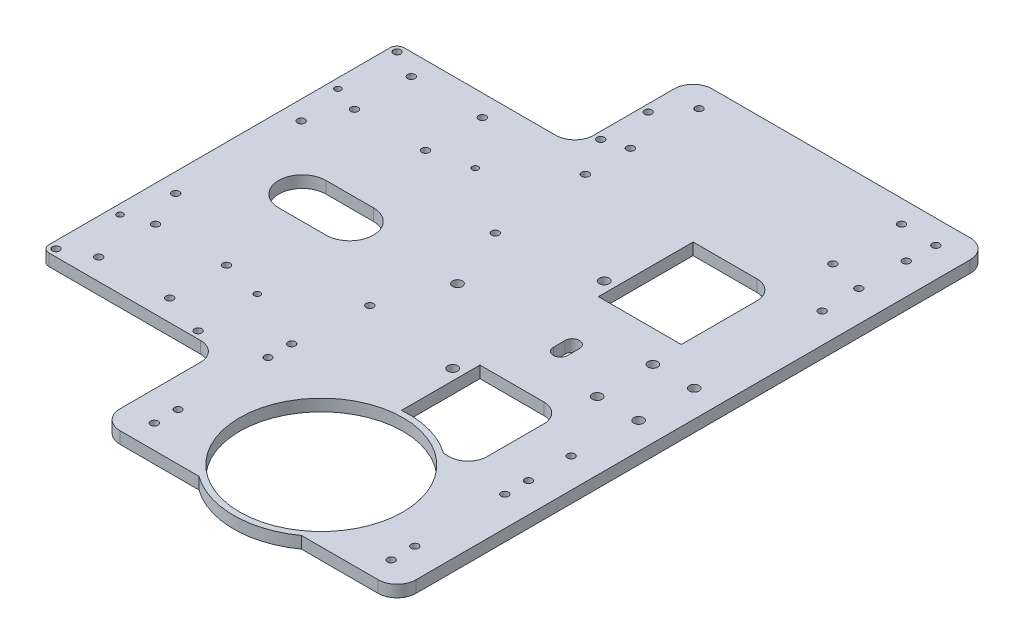
from build123d import *

# Parameters (mm, degrees)
SKETCH_1_W               = 200
SKETCH_1_H               = 250
EXTRUDE_1_DEPTH          = 5
SKETCH_2_W               = 150
SKETCH_2_H               = 100
CUT_EXTRUDE_1_DEPTH      = 10
SKETCH_3_R               = 1.55
CUT_EXTRUDE_2_DEPTH      = 10
CUT_EXTRUDE_3_DEPTH      = 10
CUT_EXTRUDE_3_DEPTH_BACK = 5
SKETCH_6_R               = 2.05
SKETCH_6_W               = 35
SKETCH_6_H               = 40
SKETCH_7_R               = 35
CUT_EXTRUDE_4_DEPTH      = 5
SKETCH_8_R               = 2.05
CUT_EXTRUDE_5_DEPTH      = 161.15617378
SKETCH_10_R              = 1.55
CUT_EXTRUDE_6_DEPTH      = 10
SKETCH_11_R              = 1.55
CUT_EXTRUDE_7_DEPTH      = 5
SKETCH_14_R              = 1.55
CUT_EXTRUDE_10_DEPTH     = 5
SKETCH_16_R              = 1.3
CUT_EXTRUDE_11_DEPTH     = 5
SKETCH_18_R              = 34.5
EXTRUDE_2_DEPTH          = 5
FILLET_1_R               = 8
SKETCH_19_R              = 1.55
CUT_EXTRUDE_12_DEPTH     = 10
SKETCH_20_R              = 1.55
CUT_EXTRUDE_13_DEPTH     = 10
CUT_EXTRUDE_14_DEPTH     = 10
FILLET_2_R               = 3
FILLET_3_R               = 8
CUT_EXTRUDE_15_DEPTH     = 10
SKETCH_23_R              = 1.55
CUT_EXTRUDE_16_DEPTH     = 10
SKETCH_24_R              = 1.55
CUT_EXTRUDE_17_DEPTH     = 10


with BuildPart() as part:
    # 草图1 → 凸台-拉伸1 (new body)
    with BuildSketch(Plane(origin=(0, 0, 0), x_dir=(1, 0, 0), z_dir=(0, 1, 0))):
        Rectangle(SKETCH_1_W, SKETCH_1_H)
    extrude(amount=EXTRUDE_1_DEPTH)

    # 草图2 → 切除-拉伸1 (cut)
    with BuildSketch(Plane(origin=(0, 5, 0), x_dir=(1, 0, 0), z_dir=(0, 1, 0))):
        with Locations((-100, 125)):
            Rectangle(SKETCH_2_W, SKETCH_2_H)
        with Locations((-100, -125)):
            Rectangle(SKETCH_2_W, SKETCH_2_H)
    extrude(amount=-CUT_EXTRUDE_1_DEPTH, mode=Mode.SUBTRACT)

    # 草图3 → 切除-拉伸2 (cut)
    with BuildSketch(Plane(origin=(0, 0, 0), x_dir=(-1, 0, 0), z_dir=(0, -1, 0))):
        with Locations(Location((85, 66, 0), (0, 0, 90))):
            Circle(SKETCH_3_R)
        with Locations(Location((55, 66, 0), (0, 0, 90))):
            Circle(SKETCH_3_R)
        with Locations(Location((55, 42, 0), (0, 0, 90))):
            Circle(SKETCH_3_R)
        with Locations(Location((85, 42, 0), (0, 0, 90))):
            Circle(SKETCH_3_R)
        with Locations(Location((55, -42, 0), (0, 0, 90))):
            Circle(SKETCH_3_R)
        with Locations(Location((85, -42, 0), (0, 0, 90))):
            Circle(SKETCH_3_R)
        with Locations(Location((55, -66, 0), (0, 0, 90))):
            Circle(SKETCH_3_R)
        with Locations(Location((85, -66, 0), (0, 0, 90))):
            Circle(SKETCH_3_R)
    extrude(amount=-CUT_EXTRUDE_2_DEPTH, mode=Mode.SUBTRACT)

    # 草图6 → 切除-拉伸3 (cut, two sides: drawn at the far end of the back side and taken through both)
    with BuildSketch(Plane(origin=(0, 0, 0), x_dir=(-1, 0, 0), z_dir=(0, -1, 0)).offset(-CUT_EXTRUDE_3_DEPTH_BACK)):
        with Locations(Location((-30.5, 32, 0), (0, 0, 270))):
            Circle(SKETCH_6_R)
        with Locations(Location((-0.5, 0, 0), (0, 0, 270))):
            Circle(SKETCH_6_R)
        with Locations(Location((-30.5, -32, 0), (0, 0, 270))):
            Circle(SKETCH_6_R)
        with Locations((-52.5, -45)):
            Rectangle(SKETCH_6_W, SKETCH_6_H)
        with Locations((-52.5, 45)):
            Rectangle(SKETCH_6_W, SKETCH_6_H)
    extrude(amount=CUT_EXTRUDE_3_DEPTH + CUT_EXTRUDE_3_DEPTH_BACK, mode=Mode.SUBTRACT)

    # 草图7 → 切除-拉伸4 (cut)
    with BuildSketch(Plane(origin=(0, 0, 0), x_dir=(-1, 0, 0), z_dir=(0, -1, 0))):
        with Locations((-38, -95)):
            Circle(SKETCH_7_R)
    extrude(amount=-CUT_EXTRUDE_4_DEPTH, mode=Mode.SUBTRACT)

    # 草图8 → 切除-拉伸5 (cut, through all)
    with BuildSketch(Plane(origin=(0, 5, 0), x_dir=(1, 0, 0), z_dir=(0, 1, 0))):
        with Locations(Location((71.25, 11.75, 0), (0, 0, 270))):
            Circle(SKETCH_8_R)
        with Locations(Location((88.75, 11.75, 0), (0, 0, 270))):
            Circle(SKETCH_8_R)
        with Locations(Location((88.75, -11.75, 0), (0, 0, 270))):
            Circle(SKETCH_8_R)
        with Locations(Location((71.25, -11.75, 0), (0, 0, 270))):
            Circle(SKETCH_8_R)
    extrude(amount=-CUT_EXTRUDE_5_DEPTH, mode=Mode.SUBTRACT)

    # 草图10 → 切除-拉伸6 (cut)
    with BuildSketch(Plane(origin=(0, 5, 0), x_dir=(1, 0, 0), z_dir=(0, 1, 0))):
        with Locations(Location((-12.5, -67, 0), (0, 0, 270))):
            Circle(SKETCH_10_R)
        with Locations(Location((-12.5, -115, 0), (0, 0, 270))):
            Circle(SKETCH_10_R)
        with Locations(Location((87.5, -67, 0), (0, 0, 270))):
            Circle(SKETCH_10_R)
        with Locations(Location((87.5, -115, 0), (0, 0, 270))):
            Circle(SKETCH_10_R)
    extrude(amount=-CUT_EXTRUDE_6_DEPTH, mode=Mode.SUBTRACT)

    # 草图11 → 切除-拉伸7 (cut)
    with BuildSketch(Plane(origin=(0, 5, 0), x_dir=(1, 0, 0), z_dir=(0, 1, 0))):
        with Locations(Location((87.5, 115, 0), (0, 0, 270))):
            Circle(SKETCH_11_R)
        with Locations(Location((87.5, 67, 0), (0, 0, 270))):
            Circle(SKETCH_11_R)
        with Locations(Location((-12.5, 115, 0), (0, 0, 270))):
            Circle(SKETCH_11_R)
        with Locations(Location((-12.5, 67, 0), (0, 0, 270))):
            Circle(SKETCH_11_R)
    extrude(amount=-CUT_EXTRUDE_7_DEPTH, mode=Mode.SUBTRACT)

    # 草图14 → 切除-拉伸10 (cut)
    with BuildSketch(Plane(origin=(0, 5, 0), x_dir=(1, 0, 0), z_dir=(0, 1, 0))):
        with Locations(Location((-92, -26.5, 0), (0, 0, 270))):
            Circle(SKETCH_14_R)
        with Locations(Location((-92, 26.5, 0), (0, 0, 270))):
            Circle(SKETCH_14_R)
        with Locations(Location((-10, 26.5, 0), (0, 0, 270))):
            Circle(SKETCH_14_R)
        with Locations(Location((-10, -26.5, 0), (0, 0, 270))):
            Circle(SKETCH_14_R)
    extrude(amount=-CUT_EXTRUDE_10_DEPTH, mode=Mode.SUBTRACT)

    # 草图16 → 切除-拉伸11 (cut)
    with BuildSketch(Plane(origin=(0, 5, 0), x_dir=(1, 0, 0), z_dir=(0, 1, 0))):
        with Locations(Location((-96, 46, 0), (0, 0, 270))):
            Circle(SKETCH_16_R)
        with Locations(Location((-38, 46, 0), (0, 0, 270))):
            Circle(SKETCH_16_R)
        with Locations(Location((-38, -46, 0), (0, 0, 270))):
            Circle(SKETCH_16_R)
        with Locations(Location((-96, -46, 0), (0, 0, 270))):
            Circle(SKETCH_16_R)
    extrude(amount=-CUT_EXTRUDE_11_DEPTH, mode=Mode.SUBTRACT)

    # 草图18 → 凸台-拉伸2 (add)
    with BuildSketch(Plane(origin=(0, 5, 0), x_dir=(1, 0, 0), z_dir=(0, 1, 0))):
        with BuildLine():
            ThreePointArc((35, -58.121822171), (12.920127592, -122.202941017), (75, -95))
            ThreePointArc((75, -95), (70.982039506, -78.231426118), (59.800807024, -65.104769392))
            ThreePointArc((59.800807024, -65.104769392), (48.0278599, -59.38480625), (35, -58.121822171))
        make_face()
        with Locations(Location((38, -95, 0), (0, 0, 270))):
            Circle(SKETCH_18_R, mode=Mode.SUBTRACT)
    extrude(amount=-EXTRUDE_2_DEPTH)

    # 圆角1
    fillet_1_edges = [part.edges().sort_by_distance(p)[0] for p in [
        (70, 2.5, -65),
        (70, 2.5, 25),
        (70, 2.5, 65),
    ]]
    fillet(fillet_1_edges, radius=FILLET_1_R)

    # 草图19 → 切除-拉伸12 (cut)
    with BuildSketch(Plane(origin=(0, 5, 0), x_dir=(1, 0, 0), z_dir=(0, 1, 0))):
        with Locations(Location((-97, 72, 0), (0, 0, 270))):
            Circle(SKETCH_19_R)
        with Locations(Location((-97, -72, 0), (0, 0, 270))):
            Circle(SKETCH_19_R)
    extrude(amount=-CUT_EXTRUDE_12_DEPTH, mode=Mode.SUBTRACT)

    # 草图20 → 切除-拉伸13 (cut)
    with BuildSketch(Plane(origin=(0, 5, 0), x_dir=(1, 0, 0), z_dir=(0, 1, 0))):
        with Locations(Location((72.498529399, 115.5, 0), (0, 0, 270))):
            Circle(SKETCH_20_R)
        with Locations(Location((72.5, 86.5, 0), (0, 0, 270))):
            Circle(SKETCH_20_R)
        with Locations(Location((87, 103, 0), (0, 0, 270))):
            Circle(SKETCH_20_R)
        with Locations(Location((87, 83, 0), (0, 0, 270))):
            Circle(SKETCH_20_R)
        with Locations(Location((-22, 103, 0), (0, 0, 270))):
            Circle(SKETCH_20_R)
        with Locations(Location((-22, 83, 0), (0, 0, 270))):
            Circle(SKETCH_20_R)
        with Locations(Location((-12.5, 86, 0), (0, 0, 270))):
            Circle(SKETCH_20_R)
    extrude(amount=-CUT_EXTRUDE_13_DEPTH, mode=Mode.SUBTRACT)

    # 草图21 → 切除-拉伸14 (cut)
    with BuildSketch(Plane(origin=(0, 5, 0), x_dir=(1, 0, 0), z_dir=(0, 1, 0))):
        with BuildLine():
            Line((-65, 10), (-45, 10))
            ThreePointArc((-45, 10), (-35, 0), (-45, -10))
            Line((-45, -10), (-65, -10))
            ThreePointArc((-65, -10), (-75, 0), (-65, 10))
        make_face()
    extrude(amount=-CUT_EXTRUDE_14_DEPTH, mode=Mode.SUBTRACT)

    # 圆角2
    fillet_2_edges = [part.edges().sort_by_distance(p)[0] for p in [
        (-100, 2.5, -75),
        (-100, 2.5, 75),
    ]]
    fillet(fillet_2_edges, radius=FILLET_2_R)

    # 圆角3
    fillet_3_edges = [part.edges().sort_by_distance(p)[0] for p in [
        (-25, 2.5, -125),
        (-25, 2.5, -75),
        (-25, 2.5, 125),
        (-25, 2.5, 75),
        (100, 2.5, 125),
        (100, 2.5, -125),
    ]]
    fillet(fillet_3_edges, radius=FILLET_3_R)

    # 草图22 → 切除-拉伸15 (cut)
    with BuildSketch(Plane(origin=(0, 0, 0), x_dir=(-1, 0, 0), z_dir=(0, -1, 0))):
        with BuildLine():
            Line((-44, 2), (-44, -3))
            ThreePointArc((-44, -3), (-47, -6), (-50, -3))
            Line((-50, -3), (-50, 2))
            ThreePointArc((-50, 2), (-47, 5), (-44, 2))
        make_face()
    extrude(amount=-CUT_EXTRUDE_15_DEPTH, mode=Mode.SUBTRACT)

    # 草图23 → 切除-拉伸16 (cut)
    with BuildSketch(Plane(origin=(0, 5, 0), x_dir=(1, 0, 0), z_dir=(0, 1, 0))):
        with Locations(Location((87.5, -39, 0), (0, 0, 270))):
            Circle(SKETCH_23_R)
        with Locations(Location((-37, -72, 0), (0, 0, 270))):
            Circle(SKETCH_23_R)
    extrude(amount=-CUT_EXTRUDE_16_DEPTH, mode=Mode.SUBTRACT)

    # 草图24 → 切除-拉伸17 (cut)
    with BuildSketch(Plane(origin=(0, 5, 0), x_dir=(1, 0, 0), z_dir=(0, 1, 0))):
        with Locations(Location((87.5, -105, 0), (0, 0, 270))):
            Circle(SKETCH_24_R)
        with Locations(Location((-12.5, -105, 0), (0, 0, 270))):
            Circle(SKETCH_24_R)
        with Locations(Location((87.5, -57, 0), (0, 0, 270))):
            Circle(SKETCH_24_R)
        with Locations(Location((-12.5, -57, 0), (0, 0, 270))):
            Circle(SKETCH_24_R)
    extrude(amount=-CUT_EXTRUDE_17_DEPTH, mode=Mode.SUBTRACT)


solid = part.part
